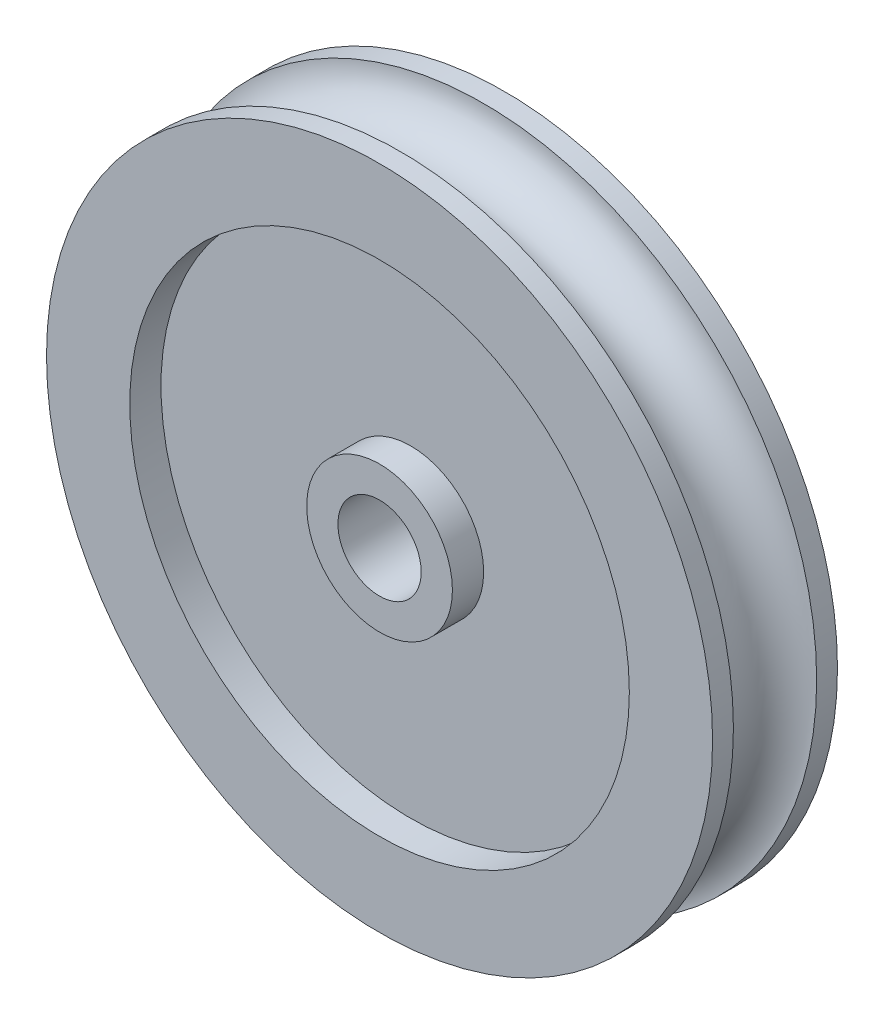
from build123d import *


with BuildPart() as part:
    # Sketch1 → Revolve1 (revolve)
    with BuildSketch(Plane(origin=(0, 0, 0), x_dir=(0, 0, -1), z_dir=(1, 0, 0)), mode=Mode.PRIVATE) as revolve1_sk:
        with BuildLine():
            Line((-9.525, 6.35), (9.525, 6.35))
            Line((9.525, 6.35), (9.525, 11.1125))
            Line((9.525, 11.1125), (4.7625, 11.1125))
            Line((4.7625, 11.1125), (4.7625, 38.1))
            Line((4.7625, 38.1), (9.525, 38.1))
            Line((9.525, 38.1), (9.525, 50.8))
            Line((9.525, 50.8), (6.35, 50.8))
            ThreePointArc((6.35, 50.8), (0, 44.45), (-6.35, 50.8))
            Line((-6.35, 50.8), (-9.525, 50.8))
            Line((-9.525, 50.8), (-9.525, 38.1))
            Line((-9.525, 38.1), (-4.7625, 38.1))
            Line((-4.7625, 38.1), (-4.7625, 11.1125))
            Line((-4.7625, 11.1125), (-9.525, 11.1125))
            Line((-9.525, 11.1125), (-9.525, 6.35))
        make_face()
    revolve(revolve1_sk.sketch.rotate(Axis((0, 0, 17.864143374), (0, 0, -1)), 90), axis=Axis((0, 0, 17.864143374), (0, 0, -1)))


solid = part.part
